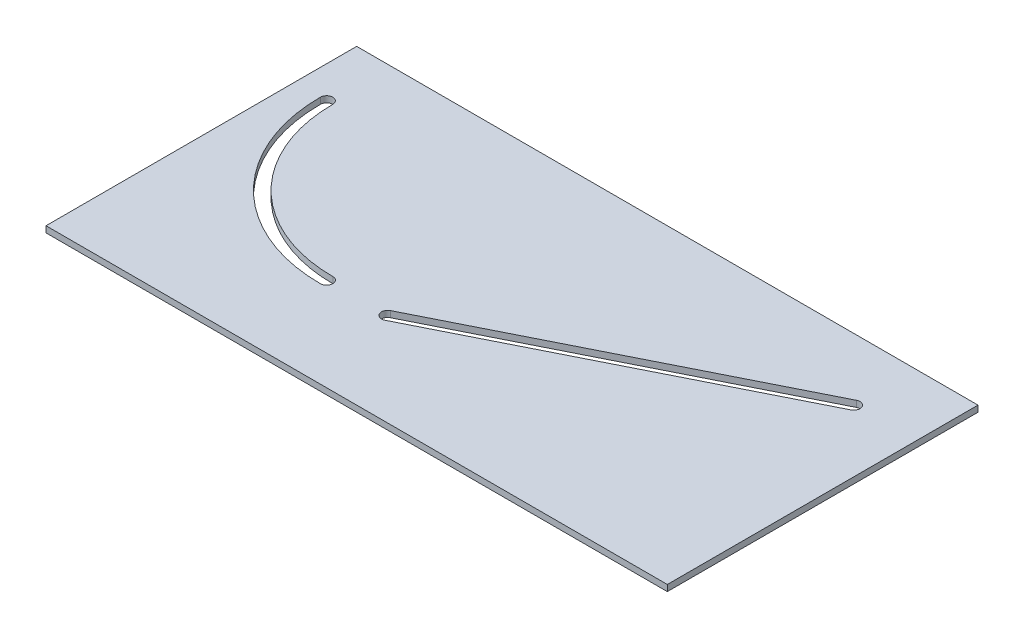
from build123d import *

# Parameters (mm, degrees)
ESQUISSE1_W             = 2000
ESQUISSE1_H             = 20
BOSS_EXTRU_1_DEPTH      = 1000
ENL_V_MAT_EXTRU_1_DEPTH = 2237.15741843


with BuildPart() as part:
    # Esquisse1 → Boss.-Extru.1 (new body)
    with BuildSketch(Plane.XY):
        with Locations((1000, 10)):
            Rectangle(ESQUISSE1_W, ESQUISSE1_H)
    extrude(amount=BOSS_EXTRU_1_DEPTH)

    # Esquisse2 → Enlèv. mat.-Extru.1 (cut, through all)
    with BuildSketch(Plane(origin=(0, 20, 0), x_dir=(1, 0, 0), z_dir=(0, 1, 0))):
        with BuildLine():
            Line((1808.94427191, -217.88854382), (808.94427191, -717.88854382))
            ThreePointArc((808.94427191, -717.88854382), (782.11145618, -708.94427191), (791.05572809, -682.11145618))
            Line((791.05572809, -682.11145618), (1791.05572809, -182.11145618))
            ThreePointArc((1791.05572809, -182.11145618), (1817.88854382, -191.05572809), (1808.94427191, -217.88854382))
        make_face()
        with BuildLine():
            ThreePointArc((83.245255668, -200), (235.549729451, -567.695526217), (603.245255668, -720))
            ThreePointArc((603.245255668, -720), (623.245255668, -700), (603.245255668, -680))
            ThreePointArc((603.245255668, -680), (263.834000698, -539.41125497), (123.245255668, -200))
            ThreePointArc((123.245255668, -200), (103.245255668, -180), (83.245255668, -200))
        make_face()
    extrude(amount=-ENL_V_MAT_EXTRU_1_DEPTH, mode=Mode.SUBTRACT)


solid = part.part
